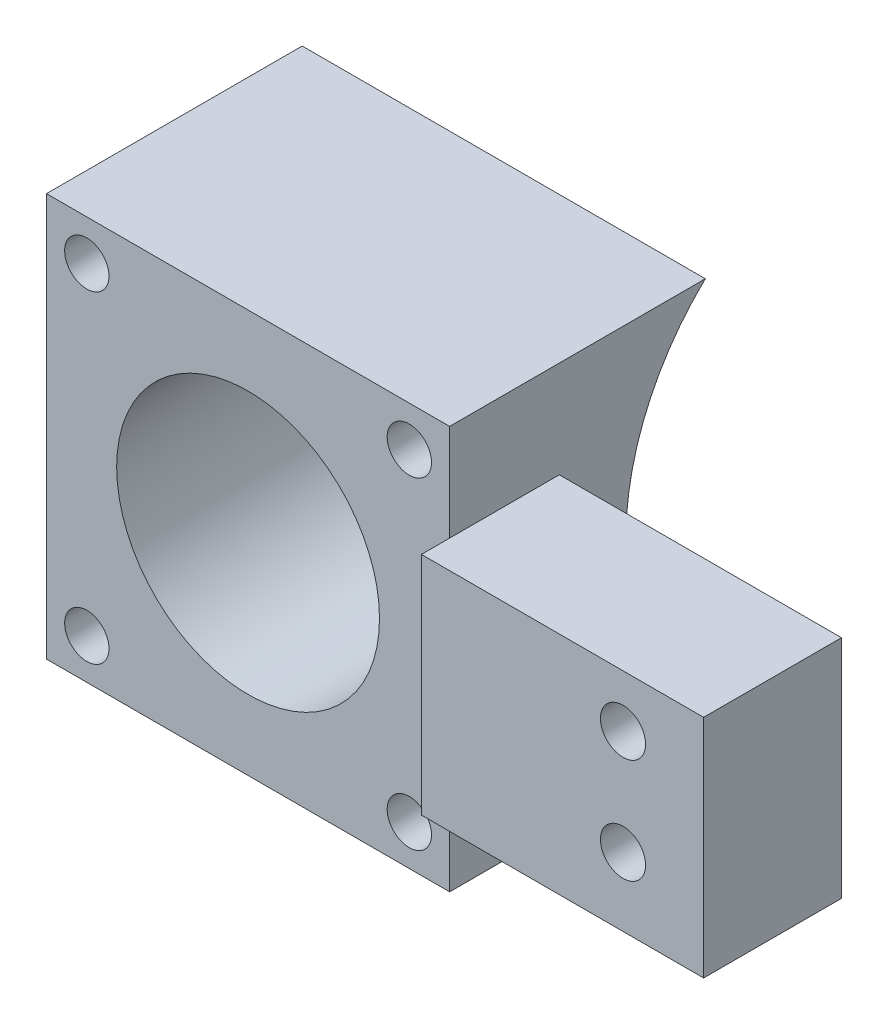
from build123d import *
from build123d.topology import SkipClean

# Parameters (mm, degrees)
SKETCH1_W               = 50
SKETCH1_H               = 50
SKETCH1_R               = 16.3
SKETCH1_R_2             = 2.75
BOSS_EXTRUDE1_DEPTH     = 53.6
CUT_EXTRUDE1_DEPTH      = 66.015075175
CUT_EXTRUDE1_DEPTH_BACK = 66.015075175
SKETCH2_R               = 31.75
BOSS_EXTRUDE3_START     = 35
BOSS_EXTRUDE3_DEPTH     = 35
CUT_EXTRUDE6_DEPTH      = 76.433606209
CUT_EXTRUDE6_DEPTH_BACK = 10
SKETCH10_R              = 2.8
CUT_EXTRUDE8_DEPTH      = 35
BOSS_EXTRUDE4_START     = 3.5
SKETCH16_W              = 35
SKETCH16_H              = 28
SKETCH16_R              = 2.8
BOSS_EXTRUDE4_DEPTH     = 3.5


with BuildPart() as part:
    # Sketch1 → Boss-Extrude1 (new body)
    with BuildSketch(Plane.XY):
        with Locations((0, -2)):
            Rectangle(SKETCH1_W, SKETCH1_H)
        with Locations((0, -2)):
            Circle(SKETCH1_R, mode=Mode.SUBTRACT)
        with Locations((-20, 18)):
            Circle(SKETCH1_R_2, mode=Mode.SUBTRACT)
        with Locations((20, 18)):
            Circle(SKETCH1_R_2, mode=Mode.SUBTRACT)
        with Locations((20, -22)):
            Circle(SKETCH1_R_2, mode=Mode.SUBTRACT)
        with Locations((-20, -22)):
            Circle(SKETCH1_R_2, mode=Mode.SUBTRACT)
    extrude(amount=BOSS_EXTRUDE1_DEPTH)

    # Sketch2 → Cut-Extrude1 (cut, two sides: drawn at the far end of the back side and taken through both)
    with BuildSketch(Plane(origin=(0, 0, 0), x_dir=(0, 0, -1), z_dir=(1, 0, 0)).offset(-CUT_EXTRUDE1_DEPTH_BACK)):
        Circle(SKETCH2_R)
    extrude(amount=CUT_EXTRUDE1_DEPTH + CUT_EXTRUDE1_DEPTH_BACK, mode=Mode.SUBTRACT)

    # Sketch4 → Boss-Extrude3 (add)
    with SkipClean():  # the faces are left unmerged after this step: merging them gives an invalid solid
        with BuildSketch(Plane(origin=(25, 0, 0), x_dir=(0, 0, -1), z_dir=(1, 0, 0)).offset(BOSS_EXTRUDE3_START)):
            with BuildLine():
                Line((-53.6, 11), (-53.6, -17))
                Line((-53.6, -17), (-26.815340759, -17))
                ThreePointArc((-26.815340759, -17), (-31.573087709, -3.347033393), (-29.783594477, 11))
                Line((-29.783594477, 11), (-53.6, 11))
            make_face()
        extrude(amount=-BOSS_EXTRUDE3_DEPTH)

    # Sketch10 → Cut-Extrude6 (cut, two sides: drawn at the far end of the back side and taken through both)
    with SkipClean():  # the faces are left unmerged after this step: merging them gives an invalid solid
        with BuildSketch(Plane.XY.offset(53.6).offset(-CUT_EXTRUDE6_DEPTH_BACK)):
            with Locations(Location((50, 4.5, 0), (0, 0, 180))):
                Circle(SKETCH10_R)
            with Locations(Location((50, -8.5, 0), (0, 0, 180))):
                Circle(SKETCH10_R)
        extrude(amount=CUT_EXTRUDE6_DEPTH + CUT_EXTRUDE6_DEPTH_BACK, mode=Mode.SUBTRACT)

    # Sketch13 → Cut-Extrude8 (cut)
    with BuildSketch(Plane(origin=(60, 0, 0), x_dir=(0, 0, -1), z_dir=(1, 0, 0))):
        with BuildLine():
            Line((-29.783594477, 11), (-40, 11))
            Line((-40, 11), (-40, -17))
            Line((-40, -17), (-26.815340759, -17))
            ThreePointArc((-26.815340759, -17), (-31.573087709, -3.347033393), (-29.783594477, 11))
        make_face()
    extrude(amount=-CUT_EXTRUDE8_DEPTH, mode=Mode.SUBTRACT)

    # Sketch16 → Boss-Extrude4 (add)
    with BuildSketch(Plane.XY.offset(53.6).offset(BOSS_EXTRUDE4_START)):
        with Locations((42.5, -3)):
            Rectangle(SKETCH16_W, SKETCH16_H)
        with Locations(Location((50, 4.5, 0), (0, 0, 180))):
            Circle(SKETCH16_R, mode=Mode.SUBTRACT)
        with Locations(Location((50, -8.5, 0), (0, 0, 180))):
            Circle(SKETCH16_R, mode=Mode.SUBTRACT)
    extrude(amount=-BOSS_EXTRUDE4_DEPTH)


solid = part.part
